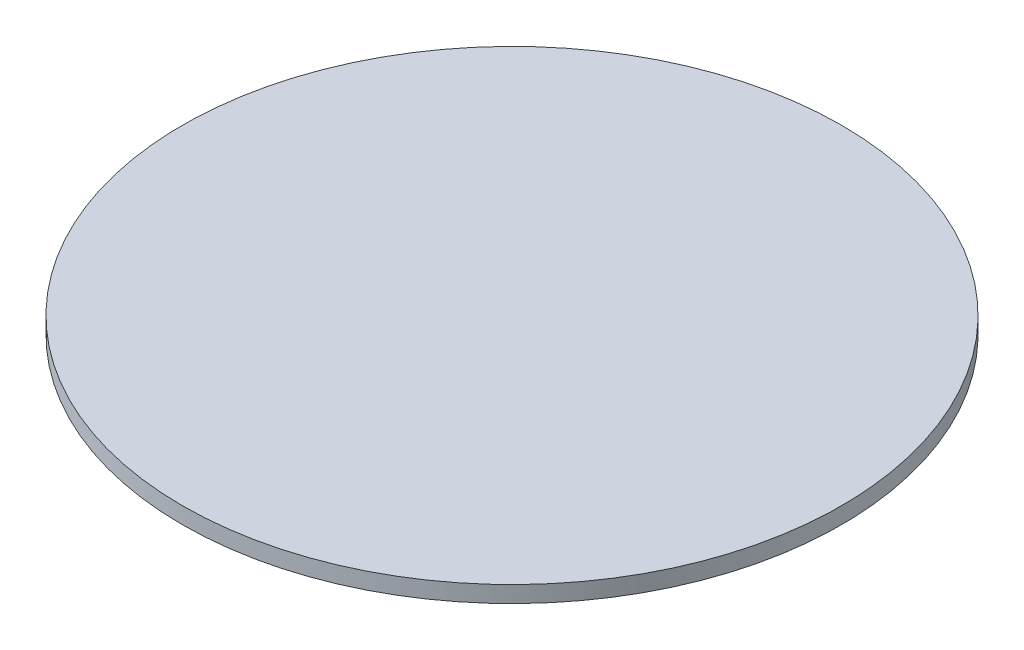
from build123d import *

# Parameters (mm, degrees)
SKETCH1_R           = 100
BOSS_EXTRUDE1_DEPTH = 5


with BuildPart() as part:
    # Sketch1 → Boss-Extrude1 (new body)
    with BuildSketch(Plane(origin=(0, 0, 0), x_dir=(1, 0, 0), z_dir=(0, 1, 0))):
        with Locations(Location((0, 0, 0), (0, 0, 270))):
            Circle(SKETCH1_R)
    extrude(amount=BOSS_EXTRUDE1_DEPTH)


solid = part.part
